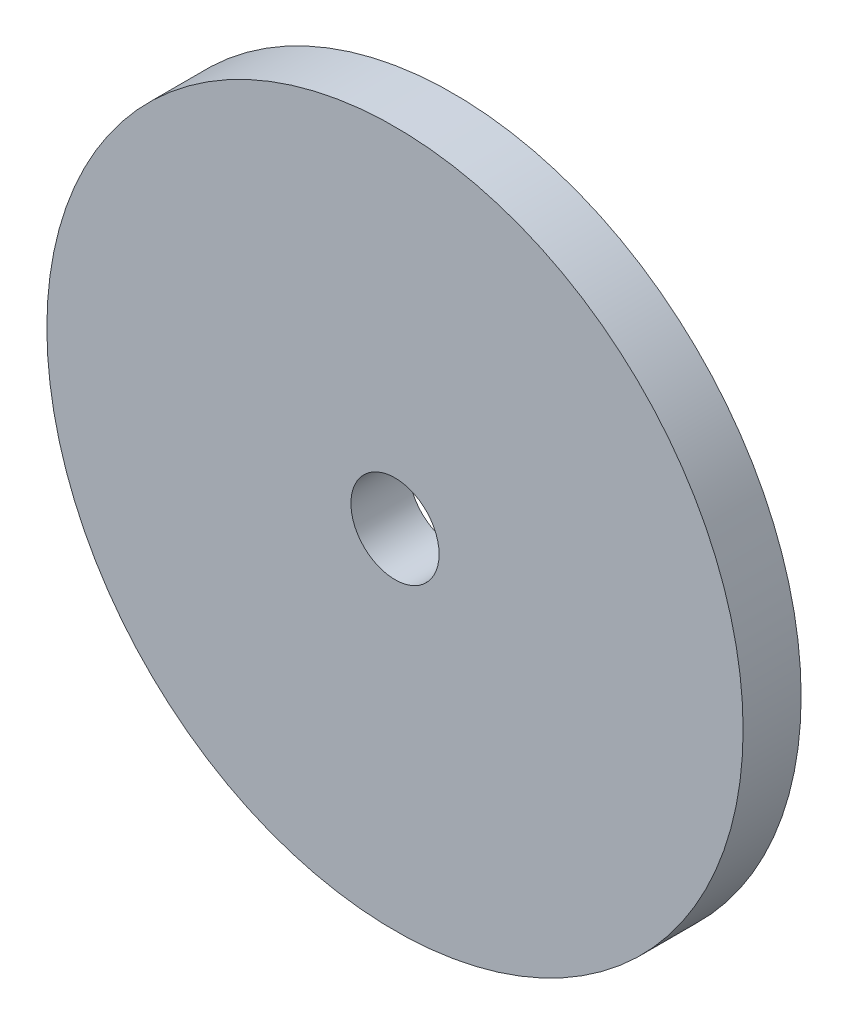
from build123d import *

# Parameters (mm, degrees)
SKETCH1_R             = 76.2
BOSS_EXTRUDE1_DEPTH   = 6.35
F_5_0MM_DOWEL_HOLE1_D = 19.304


with BuildPart() as part:
    # Sketch1 → Boss-Extrude1 (new, symmetric)
    with BuildSketch(Plane.XY):
        Circle(SKETCH1_R)
    extrude(amount=BOSS_EXTRUDE1_DEPTH, both=True)

    # Ø5.0mm Dowel Hole1 (through all)
    with Locations(Plane.XY.offset(6.35)):
        with Locations((0, 0)):
            Hole(F_5_0MM_DOWEL_HOLE1_D / 2)


solid = part.part
